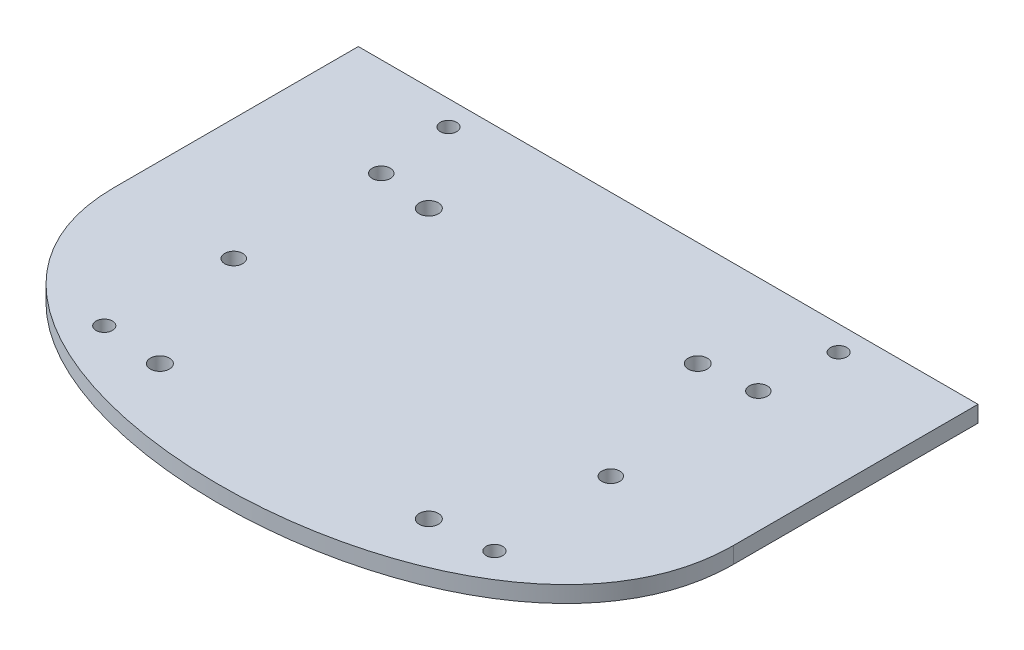
from build123d import *

# Parameters (mm, degrees)
BOSS_EXTRUDE1_DEPTH     = 2.54
CUT_EXTRUDE1_DEPTH      = 60.34583774
CUT_EXTRUDE1_DEPTH_BACK = 60.34583774
SKETCH3_R               = 1.27
SKETCH3_R_2             = 1.397
SKETCH3_R_3             = 1.480396735


with BuildPart() as part:
    # Sketch2 → Boss-Extrude1 (new body)
    with BuildSketch(Plane(origin=(0, 0, 0), x_dir=(1, 0, 0), z_dir=(0, 1, 0))):
        with BuildLine():
            Line((48.006, 34.798), (-48.006, 34.798))
            Line((-48.006, 34.798), (-48.006, -3.048))
            add(Edge.make_bspline(
                [(-48.006, -3.048), (-48.006, -45.381333333), (48.006, -45.381333333), (48.006, -3.048)],
                knots=[0, 0, 0, 0, 1, 1, 1, 1], degree=3))
            Line((48.006, -3.048), (48.006, 34.798))
        make_face()
    extrude(amount=BOSS_EXTRUDE1_DEPTH)

    # Sketch3 → Cut-Extrude1 (cut, two sides: drawn at the far end of the back side and taken through both)
    with BuildSketch(Plane(origin=(0, 2.54, 0), x_dir=(1, 0, 0), z_dir=(0, 1, 0)).offset(-CUT_EXTRUDE1_DEPTH_BACK)):
        with Locations(Location((-30.226, 30.988, 0), (0, 0, 270))):
            Circle(SKETCH3_R)
        with Locations(Location((-30.226, -22.352, 0), (0, 0, 270))):
            Circle(SKETCH3_R)
        with Locations(Location((30.226, -22.352, 0), (0, 0, 90))):
            Circle(SKETCH3_R)
        with Locations(Location((30.226, 30.988, 0), (0, 0, 90))):
            Circle(SKETCH3_R)
        with Locations(Location((-29.21, 19.558, 0), (0, 0, 270))):
            Circle(SKETCH3_R_2)
        with Locations(Location((-29.21, -3.302, 0), (0, 0, 270))):
            Circle(SKETCH3_R_2)
        with Locations(Location((29.21, -3.302, 0), (0, 0, 90))):
            Circle(SKETCH3_R_2)
        with Locations(Location((29.21, 19.558, 0), (0, 0, 90))):
            Circle(SKETCH3_R_2)
        with Locations(Location((20.834194201, 18.548194201, 0), (0, 0, 270))):
            Circle(SKETCH3_R_3)
        with Locations(Location((20.834194201, -23.120194201, 0), (0, 0, 90))):
            Circle(SKETCH3_R_3)
        with Locations(Location((-20.834194201, 18.548194201, 0), (0, 0, 90))):
            Circle(SKETCH3_R_3)
        with Locations(Location((-20.834194201, -23.120194201, 0), (0, 0, 270))):
            Circle(SKETCH3_R_3)
    extrude(amount=CUT_EXTRUDE1_DEPTH + CUT_EXTRUDE1_DEPTH_BACK, mode=Mode.SUBTRACT)


solid = part.part
